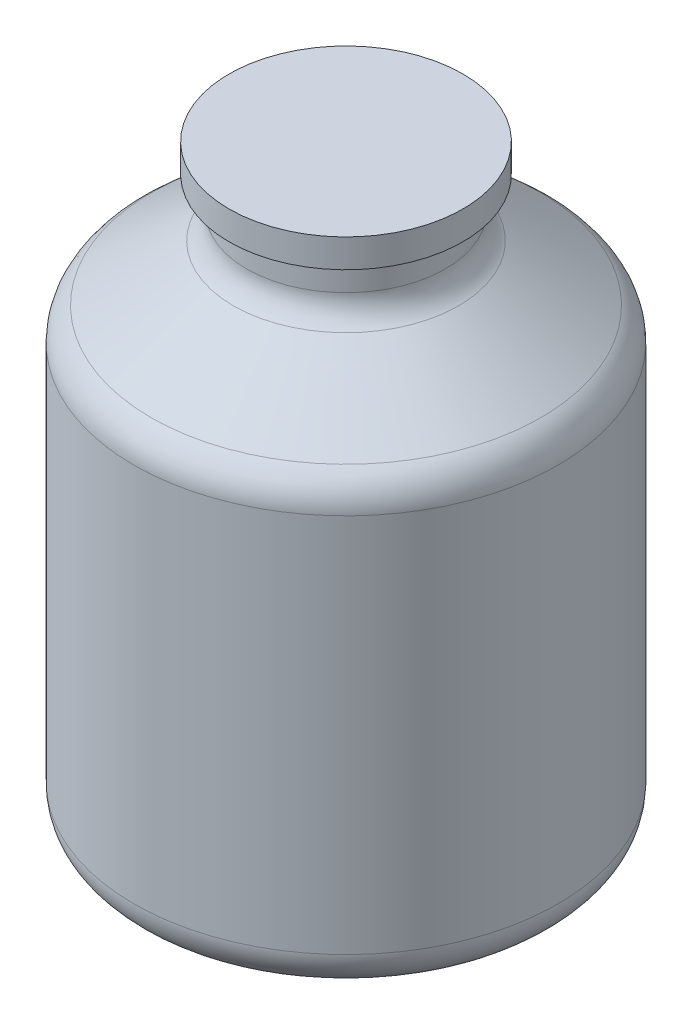
from build123d import *


with BuildPart() as part:
    # Sketch1 → Revolve1 (revolve)
    with BuildSketch(Plane.XY, mode=Mode.PRIVATE) as revolve1_sk:
        with BuildLine():
            Line((0, 0), (55.850610629, 0))
            ThreePointArc((55.850610629, 0), (64.83086675, 3.719743879), (68.550610629, 12.7))
            Line((68.550610629, 12.7), (68.550610629, 135.537090781))
            ThreePointArc((68.550610629, 135.537090781), (67.07437947, 141.479902659), (62.988876295, 146.041145392))
            Line((62.988876295, 146.041145392), (36.426242146, 164.092378593))
            ThreePointArc((36.426242146, 164.092378593), (33.255344861, 167.632513451), (32.109591896, 172.244930881))
            Line((32.109591896, 172.244930881), (32.109591896, 182.693006016))
            Line((32.109591896, 182.693006016), (37.812538782, 182.693006016))
            Line((37.812538782, 182.693006016), (37.812538782, 191.889991998))
            Line((37.812538782, 191.889991998), (0, 191.889991998))
            Line((0, 191.889991998), (0, 0))
        make_face()
    revolve(revolve1_sk.sketch.rotate(Axis((0, 191.889991998, 0), (0, -1, 0)), 90), axis=Axis((0, 191.889991998, 0), (0, -1, 0)))


solid = part.part
